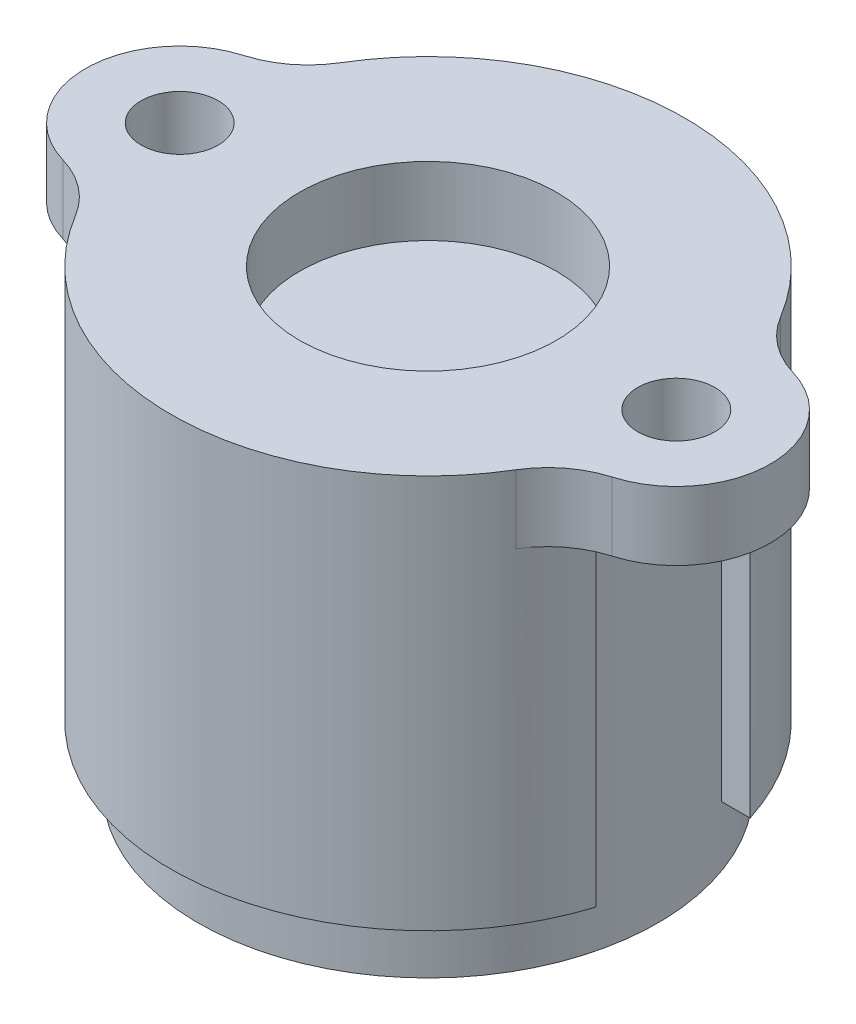
from build123d import *
from build123d.topology import SkipClean

# Parameters (mm, degrees)
BOSS_EXTRUDE1_DEPTH = 2.032
SKETCH2_R           = 3.81
SKETCH2_R_2         = 1.143
CUT_EXTRUDE1_DEPTH  = 13.861532724
BOSS_EXTRUDE2_START = 9.652
SKETCH3_R           = 7.62
SKETCH3_R_2         = 6.82
BOSS_EXTRUDE2_DEPTH = 9.652
SKETCH4_W           = 25.828848912
SKETCH4_H           = 4.572
CUT_EXTRUDE2_DEPTH  = 16.951523564
BOSS_EXTRUDE3_START = 11.43
SKETCH5_R           = 6.82
BOSS_EXTRUDE3_DEPTH = 11.43


with BuildPart() as part:
    # Sketch1 → Boss-Extrude1 (new body)
    with BuildSketch(Plane(origin=(0, 0, 0), x_dir=(1, 0, 0), z_dir=(0, 1, 0))):
        with BuildLine():
            ThreePointArc((-6.530513036, -3.926423243), (0, -7.62), (6.530513036, -3.926423243))
            ThreePointArc((6.530513036, -3.926423243), (7.220592933, -3.152220394), (8.145517241, -2.683055883))
            ThreePointArc((8.145517241, -2.683055883), (10.16, 0), (8.145517241, 2.683055883))
            ThreePointArc((8.145517241, 2.683055883), (7.220592933, 3.152220394), (6.530513036, 3.926423243))
            ThreePointArc((6.530513036, 3.926423243), (0, 7.62), (-6.530513036, 3.926423243))
            ThreePointArc((-6.530513036, 3.926423243), (-7.220592933, 3.152220394), (-8.145517241, 2.683055883))
            ThreePointArc((-8.145517241, 2.683055883), (-10.16, 0), (-8.145517241, -2.683055883))
            ThreePointArc((-8.145517241, -2.683055883), (-7.220592933, -3.152220394), (-6.530513036, -3.926423243))
        make_face()
    extrude(amount=BOSS_EXTRUDE1_DEPTH)

    # Sketch2 → Cut-Extrude1 (cut, through all)
    with BuildSketch(Plane(origin=(0, 2.032, 0), x_dir=(1, 0, 0), z_dir=(0, 1, 0))):
        with Locations(Location((0, 0, 0), (0, 0, 270))):
            Circle(SKETCH2_R)
        with Locations(Location((-7.366, 0, 0), (0, 0, 270))):
            Circle(SKETCH2_R_2)
        with Locations(Location((7.366, 0, 0), (0, 0, 270))):
            Circle(SKETCH2_R_2)
    extrude(amount=-CUT_EXTRUDE1_DEPTH, mode=Mode.SUBTRACT)

    # Sketch3 → Boss-Extrude2 (add)
    with SkipClean():  # the faces are left unmerged after this step: merging them gives an invalid solid
        with BuildSketch(Plane.XZ.offset(BOSS_EXTRUDE2_START)):
            with Locations(Location((0, 0, 0), (0, 0, 270))):
                Circle(SKETCH3_R)
            with Locations(Location((0, 0, 0), (0, 0, 171.875802718))):
                Circle(SKETCH3_R_2, mode=Mode.SUBTRACT)
        extrude(amount=-BOSS_EXTRUDE2_DEPTH)

    # Sketch4 → Cut-Extrude2 (cut, through all)
    with SkipClean():  # the faces are left unmerged after this step: merging them gives an invalid solid
        with BuildSketch(Plane.XZ):
            Rectangle(SKETCH4_W, SKETCH4_H)
        extrude(amount=CUT_EXTRUDE2_DEPTH, mode=Mode.SUBTRACT)

    # Sketch5 → Boss-Extrude3 (add)
    with SkipClean():  # the faces are left unmerged after this step: merging them gives an invalid solid
        with BuildSketch(Plane.XZ.offset(BOSS_EXTRUDE3_START)):
            with Locations(Location((0, 0, 0), (0, 0, 160.415870392))):
                Circle(SKETCH5_R)
        extrude(amount=-BOSS_EXTRUDE3_DEPTH)


solid = part.part
